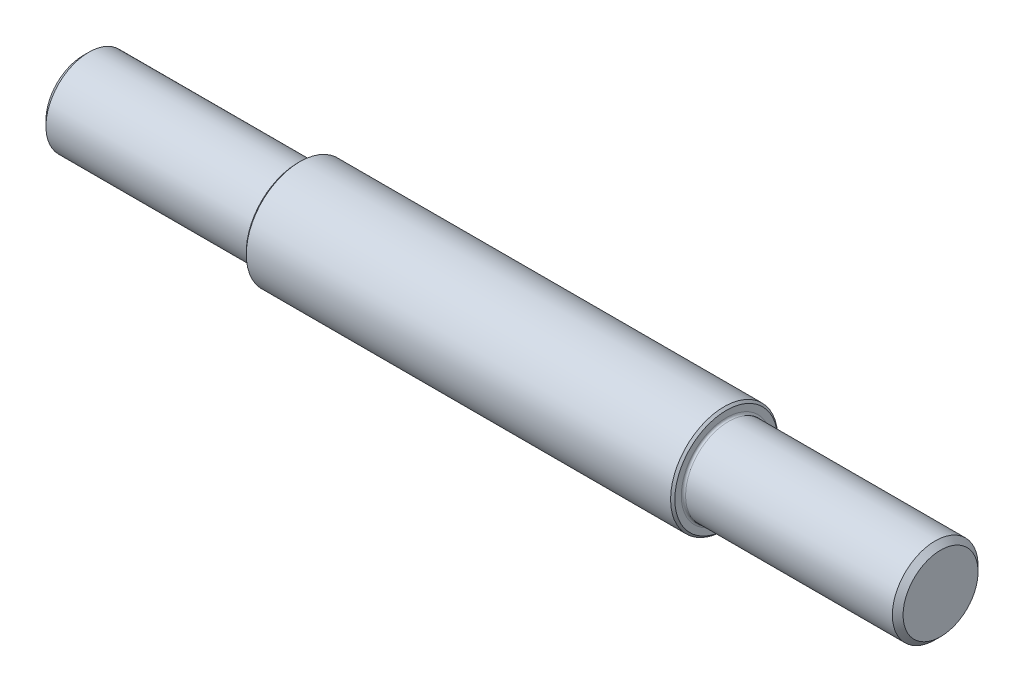
from build123d import *

# Parameters (mm, degrees)
CHAMFER1_SIZE = 0.2
CHAMFER2_SIZE = 0.2
CHAMFER3_SIZE = 0.5
CHAMFER4_SIZE = 0.5
FILLET1_R     = 0.2
FILLET2_R     = 0.2


with BuildPart() as part:
    # Sketch1 → Revolve1 (revolve)
    with BuildSketch(Plane.XY):
        Polygon((0, 0), (80, 0), (80, 4), (60, 4), (60, 5), (20, 5), (20, 4), (0, 4), align=None)
    revolve(axis=Axis((0, 0, 0), (1, 0, 0)))

    # Chamfer1
    chamfer1_edges = [part.edges().sort_by_distance(p)[0] for p in [
        (60, -5, 0),
    ]]
    chamfer(chamfer1_edges, length=CHAMFER1_SIZE)

    # Chamfer2
    chamfer2_edges = [part.edges().sort_by_distance(p)[0] for p in [
        (20, -5, 0),
    ]]
    chamfer(chamfer2_edges, length=CHAMFER2_SIZE)

    # Chamfer3
    chamfer3_edges = [part.edges().sort_by_distance(p)[0] for p in [
        (0, -4, 0),
    ]]
    chamfer(chamfer3_edges, length=CHAMFER3_SIZE)

    # Chamfer4
    chamfer4_edges = [part.edges().sort_by_distance(p)[0] for p in [
        (80, -4, 0),
    ]]
    chamfer(chamfer4_edges, length=CHAMFER4_SIZE)

    # Fillet1
    fillet1_edges = [part.edges().sort_by_distance(p)[0] for p in [
        (20, -4, 0),
    ]]
    fillet(fillet1_edges, radius=FILLET1_R)

    # Fillet2
    fillet2_edges = [part.edges().sort_by_distance(p)[0] for p in [
        (60, -4, 0),
    ]]
    fillet(fillet2_edges, radius=FILLET2_R)


solid = part.part
